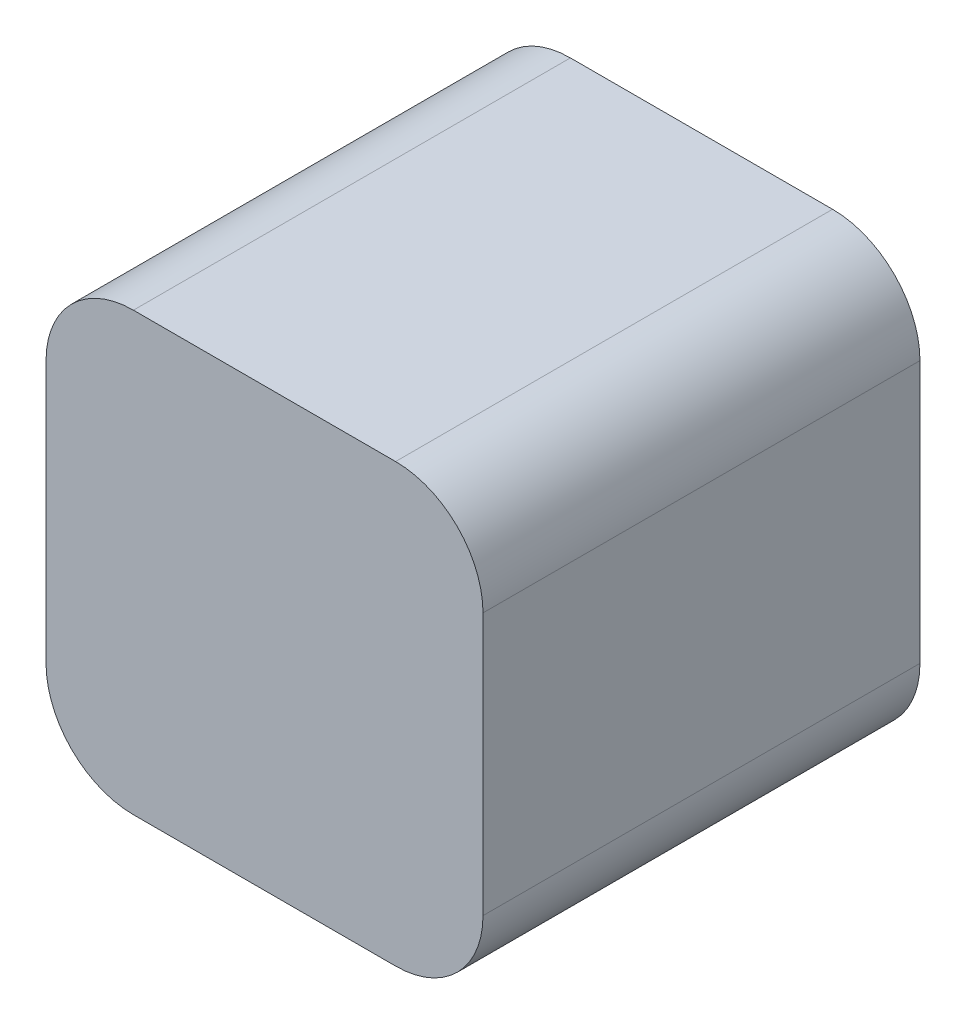
from build123d import *

# Parameters (mm, degrees)
SKETCH1_W           = 15
SKETCH1_H           = 15
BOSS_EXTRUDE1_DEPTH = 15
FILLET1_R           = 3


with BuildPart() as part:
    # Sketch1 → Boss-Extrude1 (new body)
    with BuildSketch(Plane.XY):
        Rectangle(SKETCH1_W, SKETCH1_H)
    extrude(amount=BOSS_EXTRUDE1_DEPTH)

    # Fillet1
    fillet1_edges = [part.edges().sort_by_distance(p)[0] for p in [
        (7.5, -7.5, 7.5),
        (-7.5, -7.5, 7.5),
        (-7.5, 7.5, 7.5),
        (7.5, 7.5, 7.5),
    ]]
    fillet(fillet1_edges, radius=FILLET1_R)


solid = part.part
